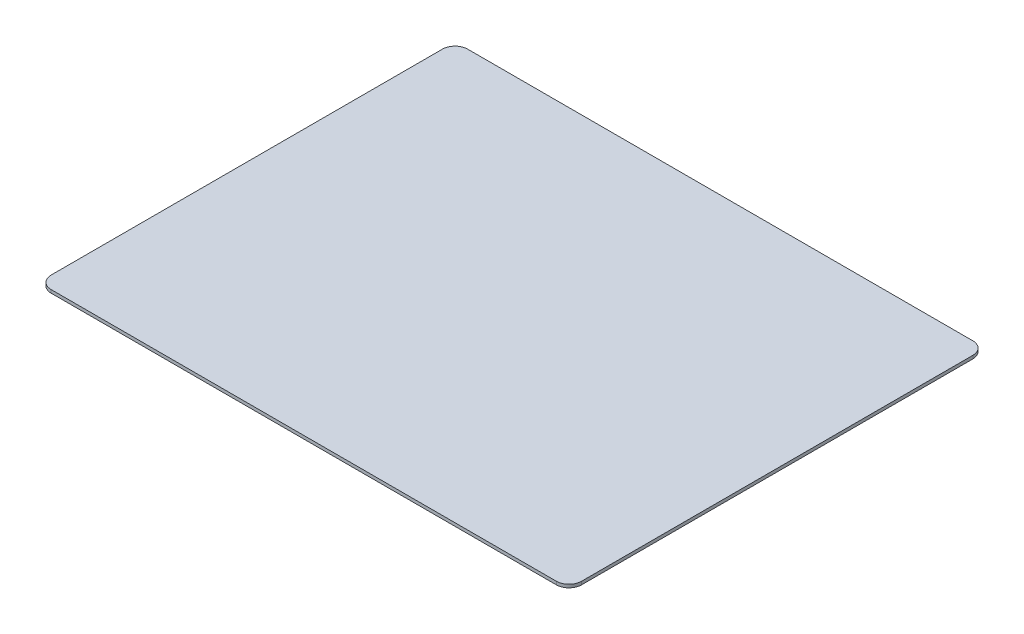
from build123d import *

# Parameters (mm, degrees)
SKETCH1_W           = 266.7
SKETCH1_H           = 209.423
BOSS_EXTRUDE1_DEPTH = 1.5875
FILLET1_R           = 6.35


with BuildPart() as part:
    # Sketch1 → Boss-Extrude1 (new body)
    with BuildSketch(Plane(origin=(0, 0, 0), x_dir=(1, 0, 0), z_dir=(0, 1, 0))):
        with Locations((133.35, 104.7115)):
            Rectangle(SKETCH1_W, SKETCH1_H)
    extrude(amount=BOSS_EXTRUDE1_DEPTH)

    # Fillet1
    fillet1_edges = [part.edges().sort_by_distance(p)[0] for p in [
        (0, 0.79375, -209.423),
        (266.7, 0.79375, -209.423),
        (266.7, 0.79375, 0),
        (0, 0.79375, 0),
    ]]
    fillet(fillet1_edges, radius=FILLET1_R)


solid = part.part
